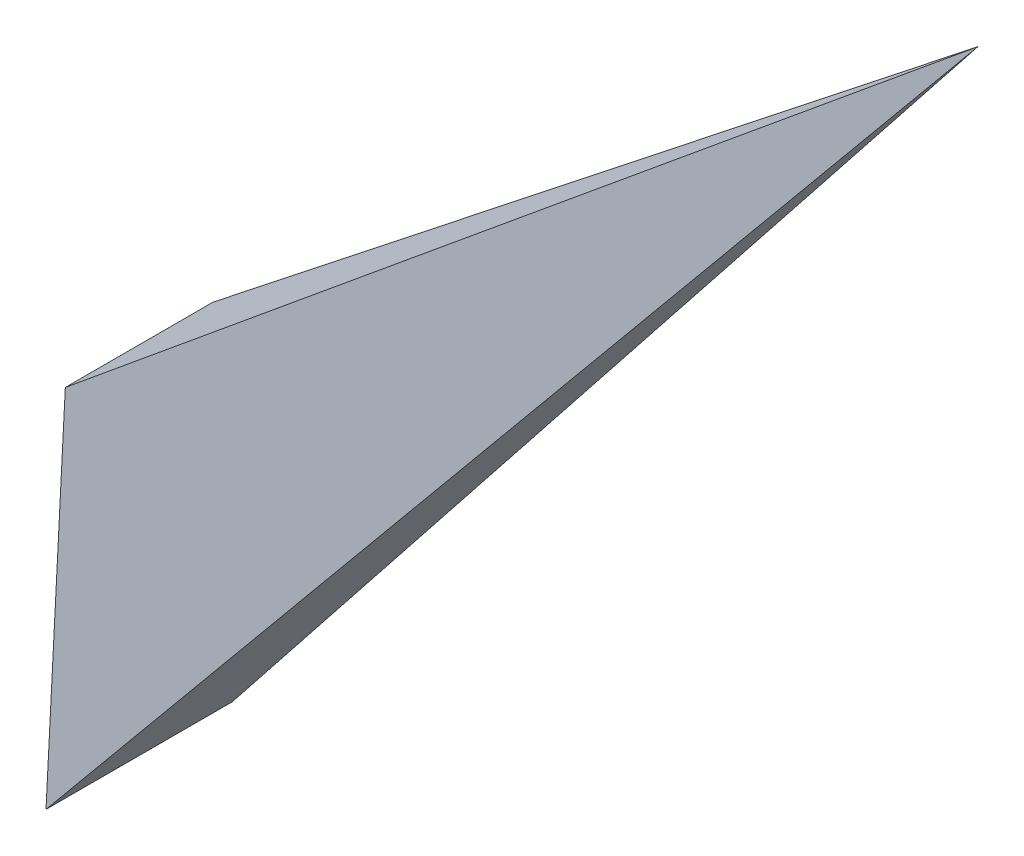
from build123d import *

# Parameters (mm, degrees)
BOSS_EXTRUDE1_DEPTH      = 508
BOSS_EXTRUDE1_DEPTH_BACK = 508
CUT_EXTRUDE2_DEPTH       = 1961.143295518
CUT_EXTRUDE2_DEPTH_BACK  = 1961.143295518
CUT_EXTRUDE7_DEPTH       = 2719.400028326
CUT_EXTRUDE7_DEPTH_BACK  = 2719.400028326


with BuildPart() as part:
    # Sketch1 → Boss-Extrude1 (new, two sides: drawn at the far end of the back side and taken through both)
    with BuildSketch(Plane(origin=(0, 0, 0), x_dir=(0, 1, 0), z_dir=(0, 0, 1)).offset(-BOSS_EXTRUDE1_DEPTH_BACK)):
        Polygon((0, 0), (1219.2, 989.685264987), (2438.4, 0), (1473.631984251, 1194.282750762), (964.768015749, 1194.282750762), align=None)
    extrude(amount=BOSS_EXTRUDE1_DEPTH + BOSS_EXTRUDE1_DEPTH_BACK)

    # Sketch2 → Cut-Extrude2 (cut, two sides: drawn at the far end of the back side and taken through both)
    with BuildSketch(Plane(origin=(-1193.155493259, 968.543643797, 0), x_dir=(0.6302416824749717, 0.7763990093187376, 0), z_dir=(0.7763990093187376, -0.6302416824749717, 0)).offset(-CUT_EXTRUDE2_DEPTH_BACK)):
        Polygon((1893.171344323, -508), (1893.171344323, 0), (-138.828655677, -142.091281869), (-138.828655677, -508), align=None)
        Polygon((-138.828655677, 142.091281869), (1893.171344323, 0), (1893.171344323, 508), (-138.828655677, 508), align=None)
    extrude(amount=CUT_EXTRUDE2_DEPTH + CUT_EXTRUDE2_DEPTH_BACK, mode=Mode.SUBTRACT)

    # Sketch5 → Cut-Extrude7 (cut, two sides: drawn at the far end of the back side and taken through both)
    with BuildSketch(Plane(origin=(0, 0, 0), x_dir=(0, 1, 0), z_dir=(0, 0, 1)).offset(-CUT_EXTRUDE7_DEPTH_BACK)):
        Polygon((2438.4, 0), (965.713353388, 1195.452980721), (0, 0), align=None)
    extrude(amount=CUT_EXTRUDE7_DEPTH + CUT_EXTRUDE7_DEPTH_BACK, mode=Mode.SUBTRACT)


solid = part.part
